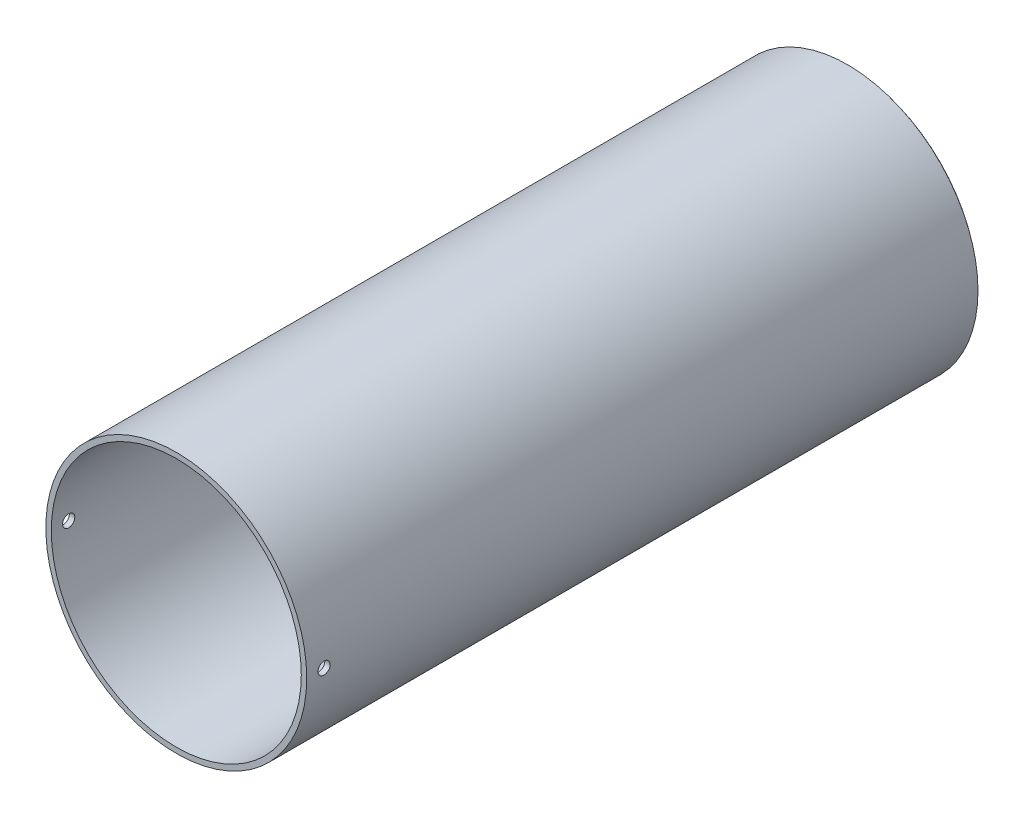
from build123d import *

# Parameters (mm, degrees)
CUT_EXTRUDE1_DEPTH      = 205.091015236
CUT_EXTRUDE1_DEPTH_BACK = 205.091015236
SKETCH2_R               = 1.778


with BuildPart() as part:
    # Sketch1 → Revolve1 (revolve)
    with BuildSketch(Plane(origin=(0, 0, 0), x_dir=(0, 0, -1), z_dir=(1, 0, 0)), mode=Mode.PRIVATE) as revolve1_sk:
        Polygon((0, 36.5125), (196.85, 36.5125), (196.85, 37.084), (196.07039578, 38.1), (0, 38.1), align=None)
    revolve(revolve1_sk.sketch.rotate(Axis((0, 0, 6.983722976), (0, 0, -1)), 90), axis=Axis((0, 0, 6.983722976), (0, 0, -1)))

    # Sketch2 → Cut-Extrude1 (cut, two sides: drawn at the far end of the back side and taken through both)
    with BuildSketch(Plane(origin=(0, 0, 0), x_dir=(0, 0, -1), z_dir=(1, 0, 0)).offset(-CUT_EXTRUDE1_DEPTH_BACK)):
        with Locations((5.08, 0)):
            Circle(SKETCH2_R)
    extrude(amount=CUT_EXTRUDE1_DEPTH + CUT_EXTRUDE1_DEPTH_BACK, mode=Mode.SUBTRACT)


solid = part.part
